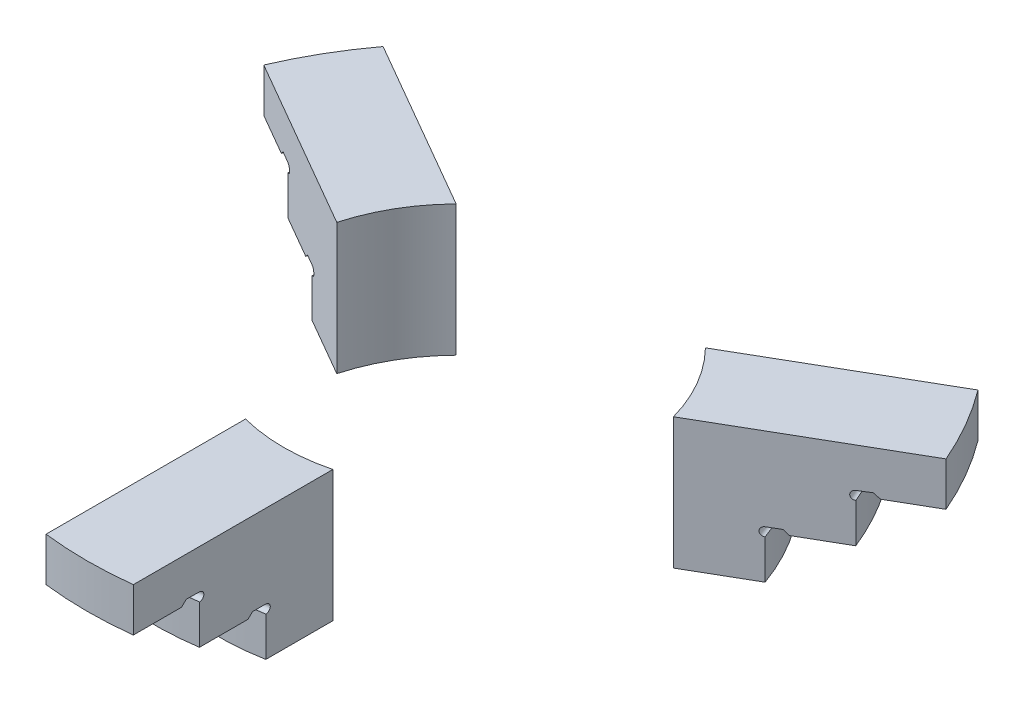
from build123d import *

# Parameters (mm, degrees)
SKETCH2_OUTSIDE_W  = 220.456
SKETCH2_OUTSIDE_H  = 220.456
CUT_EXTRUDE2_DEPTH = 124.895116934


with BuildPart() as part:
    # Sketch1 → Revolve1 (revolve)
    with BuildSketch(Plane.XY, mode=Mode.PRIVATE) as revolve1_sk:
        with BuildLine():
            Line((55, 0), (55, 9))
            ThreePointArc((55, 9), (54.000001606, 9.998208058), (54.996416123, 10.999993578))
            Line((54.996416123, 10.999993578), (57.996416123, 11.010745279))
            Line((57.996416123, 11.010745279), (59.01443228, 10))
            Line((59.01443228, 10), (70, 10))
            Line((70, 10), (70, 19))
            ThreePointArc((70, 19), (69.000030851, 19.992145002), (69.984290489, 20.999876598))
            Line((69.984290489, 20.999876598), (72.984290489, 21.047010949))
            Line((72.984290489, 21.047010949), (74.064726717, 20))
            Line((74.064726717, 20), (85, 20))
            Line((85, 20), (85, 30))
            Line((85, 30), (40, 30))
            Line((40, 30), (40, 0))
            Line((40, 0), (55, 0))
        make_face()
    revolve(revolve1_sk.sketch.rotate(Axis((0, 0, 0), (0, 1, 0)), 90), axis=Axis((0, 0, 0), (0, 1, 0)))

    # Sketch2 outside → Cut-Extrude2 (cut, through all)
    with BuildSketch(Plane(origin=(0, 0, 0), x_dir=(1, 0, 0), z_dir=(0, 1, 0))):
        Rectangle(SKETCH2_OUTSIDE_W, SKETCH2_OUTSIDE_H)
        Polygon((-81.602540378, 58.660254038), (0, 11.547005384), (81.602540378, 58.660254038), (91.602540378, 41.339745962), (10, -5.773502692), (10, -100), (-10, -100), (-10, -5.773502692), (-91.602540378, 41.339745962), align=None, mode=Mode.SUBTRACT)
    extrude(amount=CUT_EXTRUDE2_DEPTH, mode=Mode.SUBTRACT)


with BuildPart() as cut_extrude2_piece_1:
    # of the separate pieces the step leaves, piece 1, a body of its own (cut_extrude2_pieces)
    add(part.part.solids().sort_by_distance((-10, 0, 54.083269132))[0])


with BuildPart() as cut_extrude2_piece_2:
    # of the separate pieces the step leaves, piece 2, a body of its own (cut_extrude2_pieces)
    add(part.part.solids().sort_by_distance((51.837484988, 0, -18.381380528))[0])


with BuildPart() as cut_extrude2_piece_3:
    # of the separate pieces the step leaves, piece 3, a body of its own (cut_extrude2_pieces)
    add(part.part.solids().sort_by_distance((-41.837484988, 0, -35.701888604))[0])


solid = Compound([cut_extrude2_piece_1.part, cut_extrude2_piece_2.part, cut_extrude2_piece_3.part])
